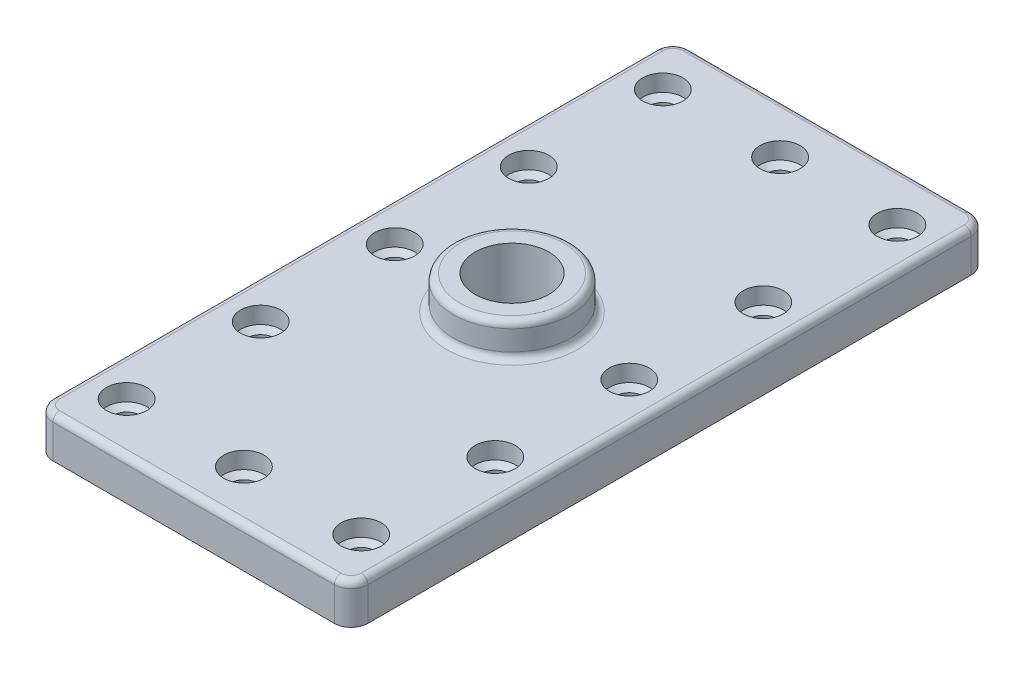
from build123d import *

# Parameters (mm, degrees)
SKETCH1_W            = 94
SKETCH1_H            = 190
PLATE_DEPTH          = 12
SKETCH2_R            = 17.5
BOSS_DEPTH           = 10
SKETCH3_R            = 11
CENTER_HOLE_DEPTH    = 109.249711316
FILLET_R5_R          = 5
FILLET_R2_R          = 2
LPATTERN1_COUNT      = 3
LPATTERN1_PITCH      = 35
LPATTERN1_COUNT_DIR2 = 5
LPATTERN1_PITCH_DIR2 = 40


with BuildPart() as part:
    # Sketch1 → plate (new body)
    with BuildSketch(Plane(origin=(0, 0, 0), x_dir=(1, 0, 0), z_dir=(0, 1, 0))):
        Rectangle(SKETCH1_W, SKETCH1_H)
    extrude(amount=PLATE_DEPTH)

    # Sketch2 → boss (add)
    with BuildSketch(Plane(origin=(0, 12, 0), x_dir=(-1, 0, 0), z_dir=(0, 1, 0))):
        with Locations(Location((0, 0, 0), (0, 0, 270))):
            Circle(SKETCH2_R)
    extrude(amount=BOSS_DEPTH)

    # Sketch3 → center hole (cut, through all)
    with BuildSketch(Plane(origin=(0, 22, 0), x_dir=(-1, 0, 0), z_dir=(0, 1, 0))):
        with Locations(Location((0, 0, 0), (0, 0, 90))):
            Circle(SKETCH3_R)
    extrude(amount=-CENTER_HOLE_DEPTH, mode=Mode.SUBTRACT)

    # Sketch4 → pattern hole (revolve, cut)
    with BuildSketch(Plane(origin=(-35, 12, 80), x_dir=(0, 0, 1), z_dir=(1, 0, 0))):
        Polygon((0, 0), (0, 12), (4, 12), (4, 6.201721238), (6, 5), (6, 0), align=None)
    pattern_hole = revolve(axis=Axis((-35, 18.130023899, 80), (0, -1, 0)), mode=Mode.SUBTRACT)

    # Fillet R5
    fillet_r5_edges = [part.edges().sort_by_distance(p)[0] for p in [
        (-47, 6, -95),
        (47, 6, -95),
        (47, 6, 95),
        (-47, 6, 95),
    ]]
    fillet(fillet_r5_edges, radius=FILLET_R5_R)

    # Fillet R2
    fillet_r2_edges = [part.edges().sort_by_distance(p)[0] for p in [
        (0, 12, 17.5),
        (0, 22, 17.5),
        (47, 12, 0),
        (0, 12, 95),
        (-47, 12, 0),
        (0, 12, -95),
        (45.535533906, 12, -93.535533906),
        (-45.535533906, 12, -93.535533906),
        (-45.535533906, 12, 93.535533906),
        (45.535533906, 12, 93.535533906),
    ]]
    fillet(fillet_r2_edges, radius=FILLET_R2_R)

    # LPattern1: pattern hole 3 × 5, 3 skipped
    with Locations(*[(i * LPATTERN1_PITCH, 0, -j * LPATTERN1_PITCH_DIR2) for i in range(LPATTERN1_COUNT) for j in range(LPATTERN1_COUNT_DIR2) if (i, j) not in ((0, 0), (1, 1), (1, 2), (1, 3))]):
        add(pattern_hole, mode=Mode.SUBTRACT)


solid = part.part
